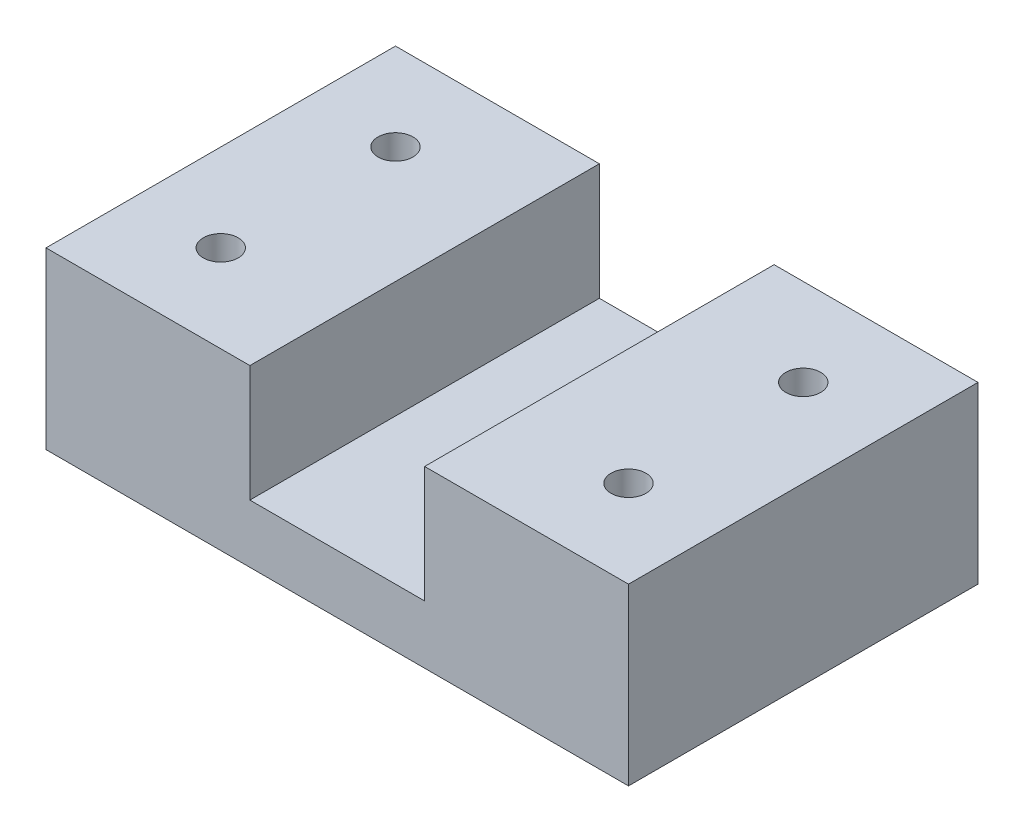
from build123d import *

# Parameters (mm, degrees)
SKETCH2_W               = 5
SKETCH2_H               = 3
BOSS_EXTRUDE1_DEPTH     = 0.5
SKETCH3_W               = 1.75
SKETCH3_H               = 3
BOSS_EXTRUDE2_DEPTH     = 1.5
CUT_EXTRUDE1_DEPTH      = 0.5
CUT_EXTRUDE1_DEPTH_BACK = 4.278719262
CUT_EXTRUDE1_START      = 1
SKETCH4_R               = 0.15


with BuildPart() as part:
    # Sketch2 → Boss-Extrude1 (new body)
    with BuildSketch(Plane(origin=(0, 0, 0), x_dir=(1, 0, 0), z_dir=(0, 1, 0))):
        Rectangle(SKETCH2_W, SKETCH2_H)
    extrude(amount=BOSS_EXTRUDE1_DEPTH)

    # Sketch3 → Boss-Extrude2 (add)
    with BuildSketch(Plane(origin=(0, 0, 0), x_dir=(1, 0, 0), z_dir=(0, 1, 0))):
        with Locations((-1.625, 0)):
            Rectangle(SKETCH3_W, SKETCH3_H)
        with Locations((1.625, 0)):
            Rectangle(SKETCH3_W, SKETCH3_H)
    extrude(amount=BOSS_EXTRUDE2_DEPTH)

    # Sketch4 → Cut-Extrude1 (cut, two sides: drawn at the far end of the back side and taken through both)
    with BuildSketch(Plane(origin=(0, 0, 0), x_dir=(1, 0, 0), z_dir=(0, 1, 0)).offset(CUT_EXTRUDE1_START - CUT_EXTRUDE1_DEPTH_BACK)):
        with Locations(Location((-1.75, 0.75, 0), (0, 0, 270))):
            Circle(SKETCH4_R)
        with Locations(Location((1.75, 0.75, 0), (0, 0, 90))):
            Circle(SKETCH4_R)
        with Locations(Location((1.75, -0.75, 0), (0, 0, 270))):
            Circle(SKETCH4_R)
        with Locations(Location((-1.75, -0.75, 0), (0, 0, 90))):
            Circle(SKETCH4_R)
    extrude(amount=CUT_EXTRUDE1_DEPTH + CUT_EXTRUDE1_DEPTH_BACK, mode=Mode.SUBTRACT)


solid = part.part
